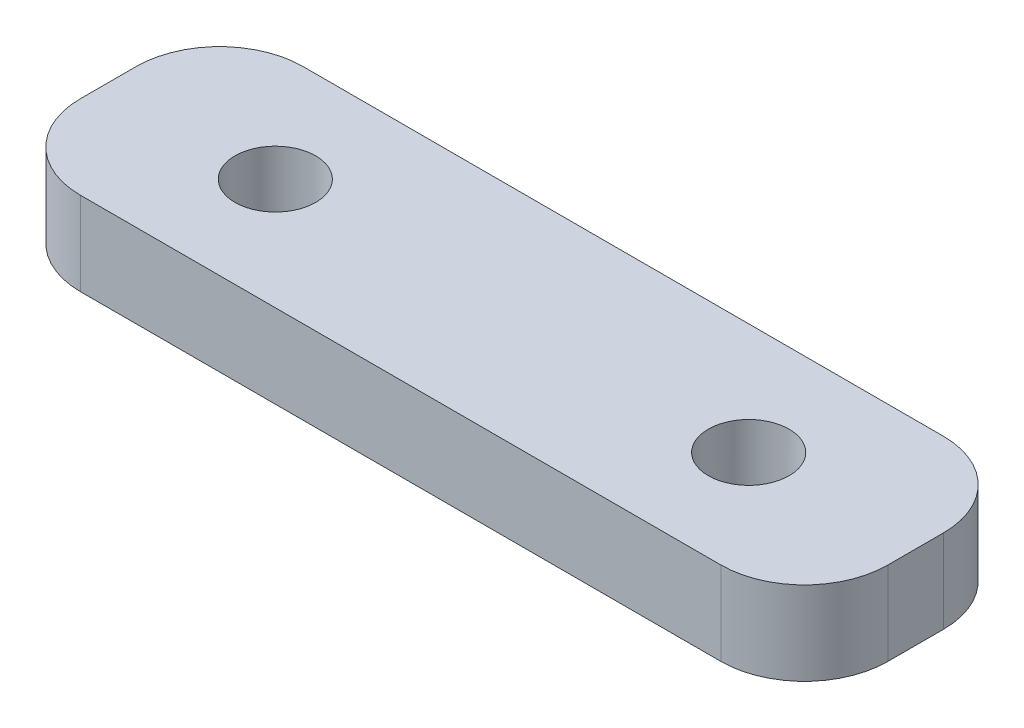
from build123d import *

# Parameters (mm, degrees)
SKETCH1_W              = 29
SKETCH1_H              = 8
BOSS_EXTRUDE1_DEPTH    = 3
M2_5_CLEARANCE_HOLE1_D = 2.9
FILLET1_R              = 3


with BuildPart() as part:
    # Sketch1 → Boss-Extrude1 (new body)
    with BuildSketch(Plane(origin=(0, 0, 0), x_dir=(1, 0, 0), z_dir=(0, 1, 0))):
        with Locations((14.5, 4)):
            Rectangle(SKETCH1_W, SKETCH1_H)
    extrude(amount=BOSS_EXTRUDE1_DEPTH)

    # M2.5 Clearance Hole1 (through all)
    with Locations(Plane(origin=(0, 3, 0), x_dir=(1, 0, 0), z_dir=(0, 1, 0))):
        with Locations((6, 4), (23, 4)):
            Hole(M2_5_CLEARANCE_HOLE1_D / 2)

    # Fillet1
    fillet1_edges = [part.edges().sort_by_distance(p)[0] for p in [
        (0, 1.5, -8),
        (29, 1.5, -8),
        (29, 1.5, 0),
        (0, 1.5, 0),
    ]]
    fillet(fillet1_edges, radius=FILLET1_R)


solid = part.part
